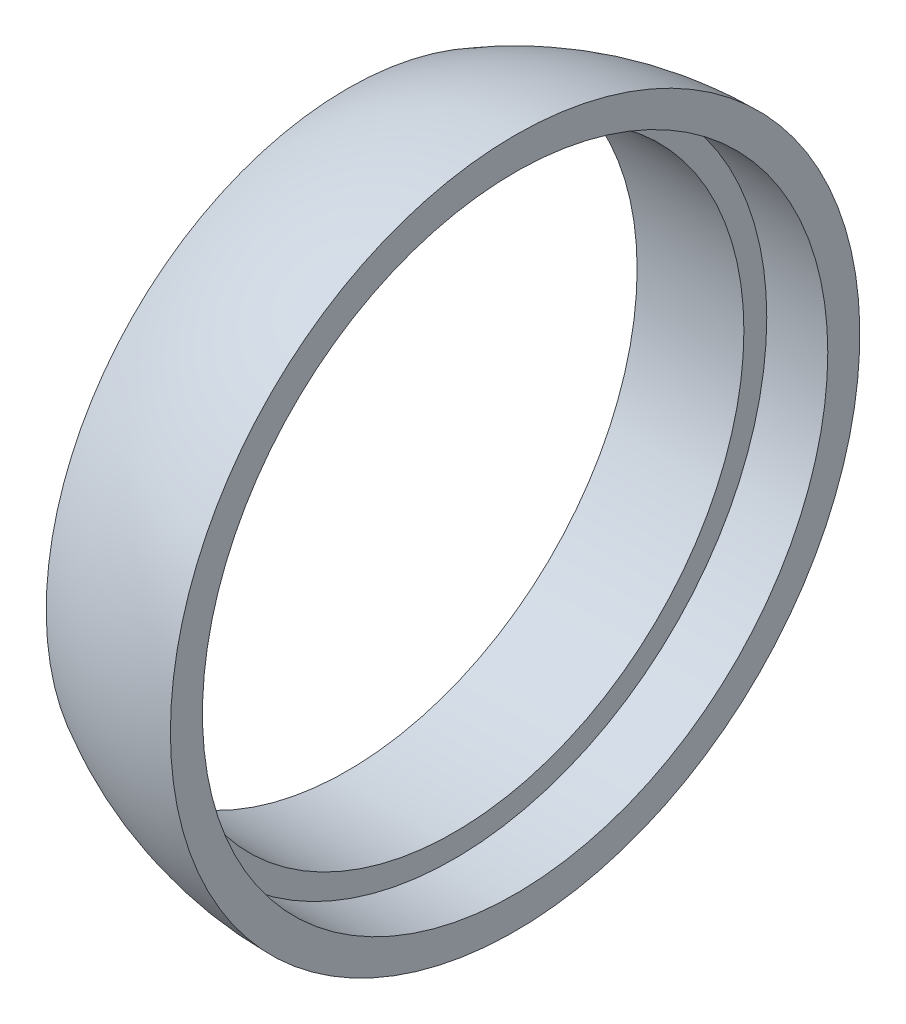
from build123d import *

# Parameters (mm, degrees)
REVOLVE_1_ANGLE          = 180
CUT_EXTRUDE_3_DEPTH      = 20.572174126
CUT_EXTRUDE_3_DEPTH_BACK = 20.572174126
SKETCH_5_W               = 6
SKETCH_5_H               = 20
SKETCH_11_R              = 9.5
CUT_EXTRUDE_7_DEPTH      = 17.900591706
SKETCH_12_R              = 10.25
CUT_EXTRUDE_8_DEPTH      = 2


with BuildPart() as part:
    # 草图1 → 旋转1 (revolve)
    with BuildSketch(Plane(origin=(0, 0, 0), x_dir=(0, 0, -1), z_dir=(1, 0, 0))):
        with BuildLine():
            Line((0, 11.3), (0, -11.3))
            ThreePointArc((0, -11.3), (-11.3, 0), (0, 11.3))
        make_face()
    revolve(axis=Axis((0, 11.3, 0), (0, -1, 0)), revolution_arc=REVOLVE_1_ANGLE)

    # 草图5 → 切除-拉伸3 (cut, two sides: drawn at the far end of the back side and taken through both)
    with BuildSketch(Plane.XY.offset(-CUT_EXTRUDE_3_DEPTH_BACK)):
        with Locations((-8.5, 0.096965289)):
            Rectangle(SKETCH_5_W, SKETCH_5_H)
    extrude(amount=CUT_EXTRUDE_3_DEPTH + CUT_EXTRUDE_3_DEPTH_BACK, mode=Mode.SUBTRACT)

    # 草图11 → 切除-拉伸7 (cut, through all)
    with BuildSketch(Plane(origin=(0, 0, 0), x_dir=(0, 0, -1), z_dir=(1, 0, 0))):
        Circle(SKETCH_11_R)
    extrude(amount=-CUT_EXTRUDE_7_DEPTH, mode=Mode.SUBTRACT)

    # 草图12 → 切除-拉伸8 (cut)
    with BuildSketch(Plane(origin=(0, 0, 0), x_dir=(0, 0, -1), z_dir=(1, 0, 0))):
        Circle(SKETCH_12_R)
    extrude(amount=-CUT_EXTRUDE_8_DEPTH, mode=Mode.SUBTRACT)


solid = part.part
